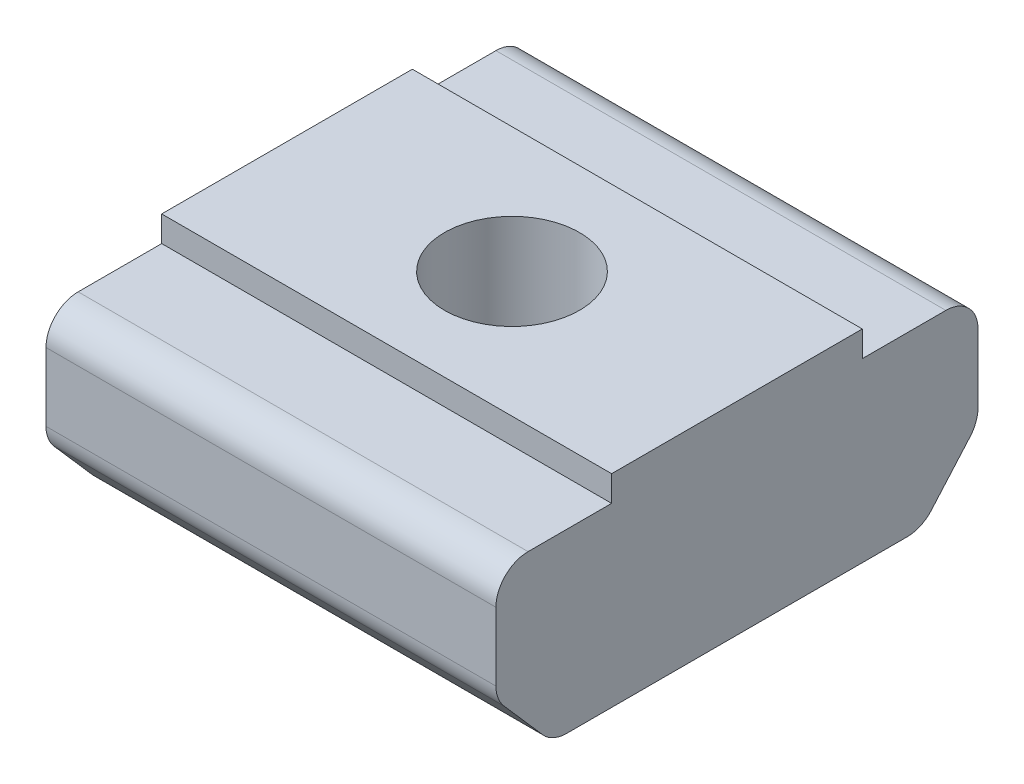
from build123d import *

# Parameters (mm, degrees)
BOSS_EXTRUDE1_DEPTH = 14
FILLET1_R           = 1
TAPPED_HOLE1_D      = 4.2


with BuildPart() as part:
    # Sketch1 → Boss-Extrude1 (new body)
    with BuildSketch(Plane(origin=(-7, 0, 0), x_dir=(0, 0, -1), z_dir=(1, 0, 0))):
        Polygon((5.75, -6.3), (-5.75, -6.3), (-7.5, -4.3), (-7.5, -0.8), (-3.9, -0.8), (-3.9, 0), (3.9, 0), (3.9, -0.8), (7.5, -0.8), (7.5, -4.3), align=None)
    extrude(amount=BOSS_EXTRUDE1_DEPTH)

    # Fillet1
    fillet1_edges = [part.edges().sort_by_distance(p)[0] for p in [
        (0, -0.8, -7.5),
        (0, -4.3, -7.5),
        (0, -6.3, -5.75),
        (0, -6.3, 5.75),
        (0, -4.3, 7.5),
        (0, -0.8, 7.5),
    ]]
    fillet(fillet1_edges, radius=FILLET1_R)

    # Tapped Hole1 (through all)
    with Locations(Plane(origin=(0, 0, 0), x_dir=(1, 0, 0), z_dir=(0, 1, 0))):
        with Locations((0, 0)):
            Hole(TAPPED_HOLE1_D / 2)


solid = part.part
